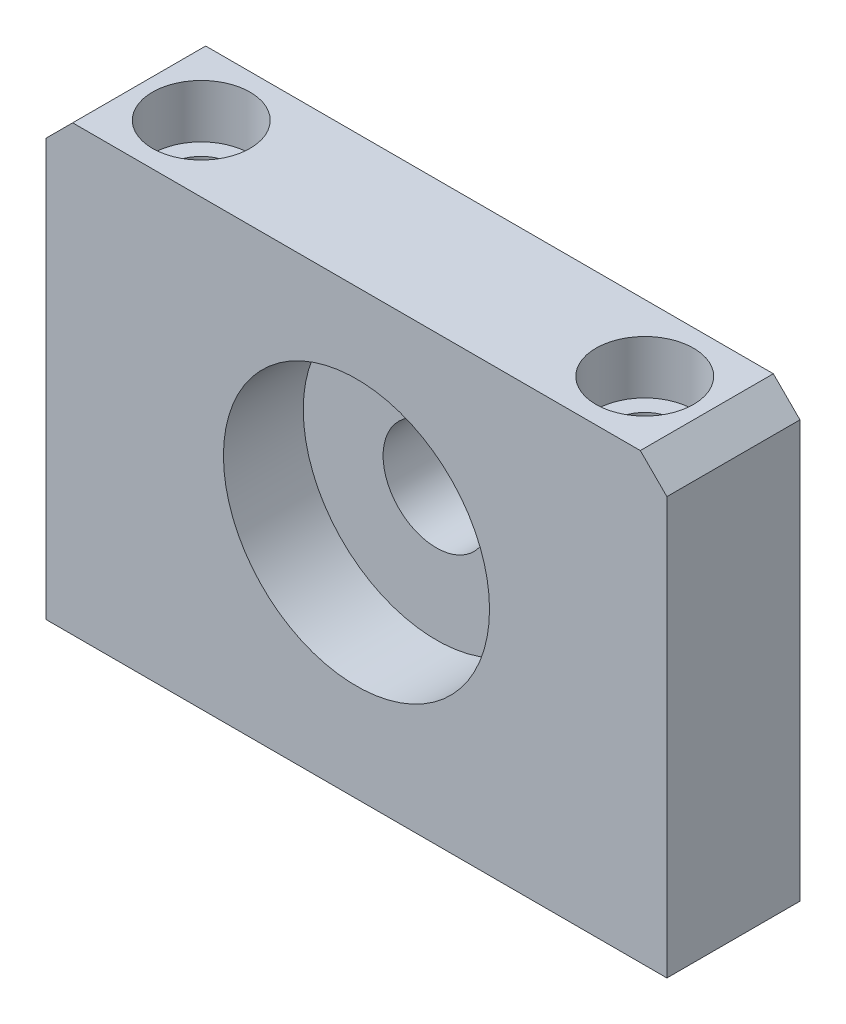
from build123d import *

# Parameters (mm, degrees)
SKETCH_1_W                   = 70
SKETCH_1_H                   = 50
EXTRUDE_1_DEPTH              = 15
SKETCH_2_R                   = 6
CUT_EXTRUDE_1_DEPTH          = 88.321245983
CHAMFER_1_SIZE               = 3
HOLE_WIZARD_M6_1_D           = 7
HOLE_WIZARD_M6_1_CBORE_D     = 11
HOLE_WIZARD_M6_1_CBORE_DEPTH = 6
SKETCH_5_R                   = 15
CUT_EXTRUDE_2_DEPTH          = 9


with BuildPart() as part:
    # 草图1 → 凸台-拉伸1 (new body)
    with BuildSketch(Plane.XY):
        with Locations((35, 25)):
            Rectangle(SKETCH_1_W, SKETCH_1_H)
    extrude(amount=EXTRUDE_1_DEPTH)

    # 草图2 → 切除-拉伸1 (cut, through all)
    with BuildSketch(Plane.XY.offset(15)):
        with Locations((35, 26)):
            Circle(SKETCH_2_R)
    extrude(amount=-CUT_EXTRUDE_1_DEPTH, mode=Mode.SUBTRACT)

    # 倒角1
    chamfer_1_edges = [part.edges().sort_by_distance(p)[0] for p in [
        (0, 50, 7.5),
        (70, 50, 7.5),
    ]]
    chamfer(chamfer_1_edges, length=CHAMFER_1_SIZE)

    # M6 六角凹头螺钉的柱形沉头孔1 (through all)
    with Locations(Plane(origin=(0, 50, 0), x_dir=(-1, 0, 0), z_dir=(0, 1, 0))):
        with Locations((-10, 7.5), (-60, 7.5)):
            CounterBoreHole(HOLE_WIZARD_M6_1_D / 2, HOLE_WIZARD_M6_1_CBORE_D / 2, HOLE_WIZARD_M6_1_CBORE_DEPTH)

    # 草图5 → 切除-拉伸2 (cut)
    with BuildSketch(Plane.XY.offset(15)):
        with Locations((35, 26)):
            Circle(SKETCH_5_R)
    extrude(amount=-CUT_EXTRUDE_2_DEPTH, mode=Mode.SUBTRACT)


solid = part.part
